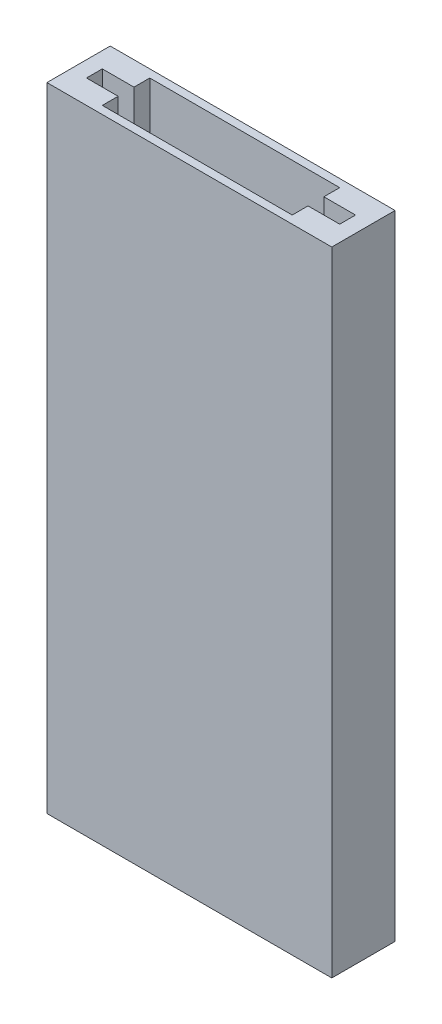
from build123d import *

# Parameters (mm, degrees)
SKETCH1_W           = 57.15
SKETCH1_H           = 127
BOSS_EXTRUDE1_DEPTH = 6.35
SKETCH2_W           = 50.8
SKETCH2_H           = 120.65
CUT_EXTRUDE1_DEPTH  = 1.5875
SKETCH3_W           = 38.1
SKETCH3_H           = 44.45
CUT_EXTRUDE2_DEPTH  = 4.7625


with BuildPart() as part:
    # Sketch1 → Boss-Extrude1 (new, symmetric)
    with BuildSketch(Plane.XY):
        Rectangle(SKETCH1_W, SKETCH1_H)
    extrude(amount=BOSS_EXTRUDE1_DEPTH, both=True)

    # Sketch2 → Cut-Extrude1 (cut, symmetric)
    with BuildSketch(Plane.XY):
        with Locations((0, 3.175)):
            Rectangle(SKETCH2_W, SKETCH2_H)
    extrude(amount=CUT_EXTRUDE1_DEPTH, both=True, mode=Mode.SUBTRACT)

    # Sketch3 → Cut-Extrude2 (cut, symmetric)
    with BuildSketch(Plane.XY):
        with Locations((0, 41.275)):
            Rectangle(SKETCH3_W, SKETCH3_H)
    extrude(amount=CUT_EXTRUDE2_DEPTH, both=True, mode=Mode.SUBTRACT)


solid = part.part
